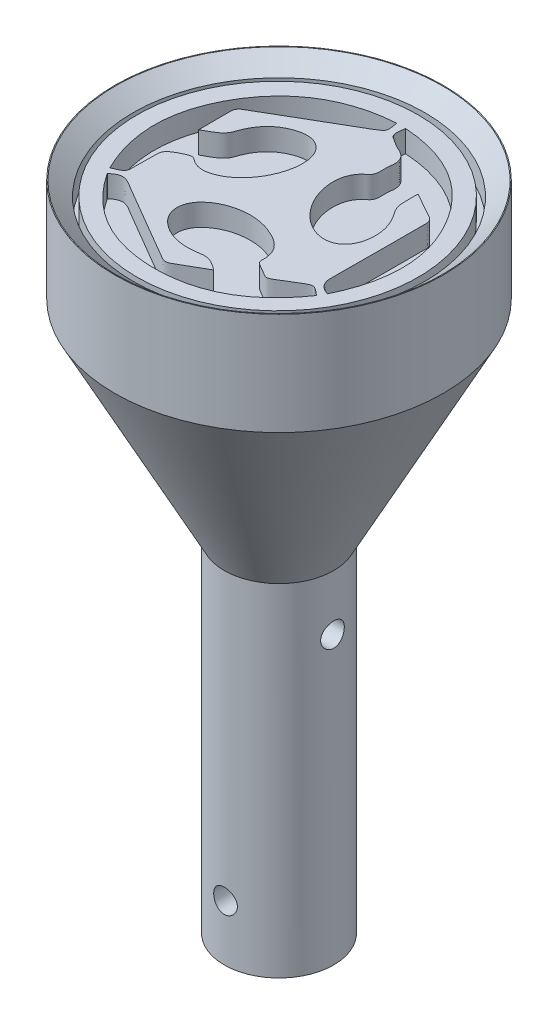
from build123d import *

# Parameters (mm, degrees)
SCHIZZO1_W                   = 22.5
SCHIZZO1_H                   = 14.04
ESTRUSIONE_ESTRUSIONE1_START = 9.96
SCHIZZO4_R                   = 19.25664473
ESTRUSIONE_ESTRUSIONE1_DEPTH = 3
TAGLIO_ESTRUSIONE1_START     = 8.039866
TAGLIO_ESTRUSIONE1_DEPTH     = 3
TAGLIO_ESTRUSIONE2_START     = 8.038452
TAGLIO_ESTRUSIONE2_DEPTH     = 3
TAGLIO_ESTRUSIONE3_START     = 8.039866
TAGLIO_ESTRUSIONE3_DEPTH     = 3
SCHIZZO17_R                  = 7.5
ESTRUSIONE_ESTRUSIONE2_DEPTH = 46.78
SCHIZZO18_R                  = 1.62
TAGLIO_ESTRUSIONE4_DEPTH     = 15
SCHIZZO19_R                  = 1.62
TAGLIO_ESTRUSIONE5_DEPTH     = 15


with BuildPart() as part:
    # Schizzo1 → Rivoluzione1 (revolve)
    with BuildSketch(Plane(origin=(0, 0, 0), x_dir=(-1, 0, 0), z_dir=(0, 0, -1)), mode=Mode.PRIVATE) as rivoluzione1_sk:
        with Locations((-11.25, 7.02)):
            Rectangle(SCHIZZO1_W, SCHIZZO1_H)
    revolve(rivoluzione1_sk.sketch.rotate(Axis((0, 0, 0), (0, 1, 0)), 270), axis=Axis((0, 0, 0), (0, 1, 0)))

    # Schizzo2 → Preforo Helicoil M39-1 (revolve, cut)
    with BuildSketch(Plane(origin=(0, 14.04, 0), x_dir=(0, 0, 1), z_dir=(1, 0, 0))):
        Polygon((0, 0), (0, 5), (20, 5), (20, 2), (22.383507185, 0), align=None)
    revolve(axis=Axis((0, 20.39, 0), (0, -1, 0)), mode=Mode.SUBTRACT)

    # Schizzo4 → Estrusione-Estrusione1 (add)
    with BuildSketch(Plane(origin=(0, 19.000000037, 0), x_dir=(0, 0, 1), z_dir=(0, -1, 0)).offset(ESTRUSIONE_ESTRUSIONE1_START)):
        with Locations(Location((-0.020858066, 0.208813711, 0), (0, 0, 180))):
            Circle(SCHIZZO4_R)
    extrude(amount=-ESTRUSIONE_ESTRUSIONE1_DEPTH)

    # Schizzo5 → Taglio-Estrusione1 (cut)
    with BuildSketch(Plane(origin=(0, 4.000133911, 0), x_dir=(1, 0, 0), z_dir=(0, 1, 0)).offset(TAGLIO_ESTRUSIONE1_START)):
        with BuildLine():
            ThreePointArc((-14.498983829, -9.052170214), (-14.514745196, -9.026539942), (-14.529323026, -9.000218499))
            add(Edge.make_bspline(
                [(-14.529323026, -9.000218499), (-14.529641415, -8.999151133), (-14.530280637, -8.997008207), (-14.530056766, -8.993645384), (-14.529950089, -8.990316308), (-14.529798352, -8.986975715), (-14.529686471, -8.983637022), (-14.529608776, -8.980296544), (-14.529561219, -8.976955745), (-14.529555498, -8.974728319), (-14.529552637, -8.973614621)],
                knots=[0, 0, 0, 0, 0.124118525, 0.24918984, 0.374331297, 0.499471254, 0.624605389, 0.749736518, 0.874870032, 1, 1, 1, 1], degree=3))
            add(Edge.make_bspline(
                [(-14.529552637, -8.973614621), (-14.409052554, -8.866308483), (-14.168089634, -8.651729374), (-13.748223192, -8.402122462), (-13.275247677, -8.2700587), (-12.782002183, -8.293560383), (-12.324948959, -8.466527336), (-11.898171374, -8.698032627), (-11.485510148, -8.95554959), (-11.067143204, -9.205223011), (-10.649380013, -9.455939957), (-10.230793941, -9.705263438), (-9.811813527, -9.953926531), (-9.392372075, -10.201811774), (-8.972535733, -10.449029569), (-8.552334742, -10.695629499), (-8.131808515, -10.941677707), (-7.710993915, -11.187235956), (-7.289928487, -11.43236718), (-6.868649592, -11.677134002), (-6.447194642, -11.921599127), (-6.025601034, -12.165825237), (-5.603906172, -12.409875024), (-5.182147019, -12.653811407), (-4.760359974, -12.897697732), (-4.338581019, -13.141597277), (-3.916846834, -13.385574084), (-3.495192366, -13.62968877), (-3.073660304, -13.874014021), (-2.652264596, -14.118577389), (-2.231106925, -14.363539417), (-1.81016831, -14.608918463), (-1.390399259, -14.856151018), (-0.968756814, -15.099962757), (-0.556932312, -15.354818005), (-0.068927793, -15.480438957), (0.405268878, -15.318576726), (0.807838051, -15.054215883), (1.226212551, -14.809801259), (1.643583004, -14.565166166), (2.063596443, -14.32475606), (2.484599852, -14.086225997), (2.906395128, -13.849068901), (3.328360689, -13.612223534), (3.750130375, -13.375026019), (4.030535608, -13.215527538), (4.170737876, -13.135778495)],
                knots=[0, 0, 0, 0, 0.022616665, 0.045226338, 0.067917642, 0.090546644, 0.113216619, 0.135873059, 0.158665913, 0.181457604, 0.204249116, 0.227040562, 0.249832034, 0.272623544, 0.295415086, 0.318206693, 0.340998385, 0.363790165, 0.386582029, 0.409373959, 0.432165929, 0.454957905, 0.47774985, 0.500541719, 0.523333537, 0.546125354, 0.568917168, 0.591708978, 0.614500788, 0.637292605, 0.660084418, 0.682876215, 0.70566804, 0.728459882, 0.751197773, 0.773725796, 0.7962676, 0.818905442, 0.841546098, 0.86418361, 0.886819813, 0.909455758, 0.932091839, 0.954728002, 0.977364057, 1, 1, 1, 1], degree=3))
            add(Edge.make_bspline(
                [(4.155731732, -13.108891566), (4.156691981, -13.109754626), (4.15861866, -13.111486302), (4.160588929, -13.114859411), (4.162333043, -13.118311759), (4.163929593, -13.121847599), (4.165547525, -13.125370387), (4.16720543, -13.128875301), (4.168917083, -13.132354713), (4.170130865, -13.134637085), (4.170737876, -13.135778495)],
                knots=[0, 0, 0, 0, 0.124254982, 0.249310022, 0.374365334, 0.499493504, 0.624630922, 0.74974305, 0.874846877, 1, 1, 1, 1], degree=3))
            add(Edge.make_bspline(
                [(4.155731732, -13.108891566), (4.075820273, -13.050477393), (3.916025382, -12.933669534), (3.674759095, -12.760698937), (3.428628585, -12.594570584), (3.175299252, -12.439678709), (2.913373983, -12.300703536), (2.639063663, -12.188160155), (2.353445783, -12.108480569), (2.06065572, -12.062675555), (1.764865582, -12.052075006), (1.469290044, -12.07579926), (1.177331374, -12.130723075), (0.88365547, -12.177388103), (0.589312141, -12.212779896), (0.295044662, -12.238438702), (0.000719186, -12.253522362), (-0.293638793, -12.257841528), (-0.588037493, -12.251073272), (-0.882475791, -12.232813283), (-1.177019681, -12.202707839), (-1.471513612, -12.160241407), (-1.765065336, -12.104659953), (-2.056157118, -12.035992408), (-2.343058892, -11.954007922), (-2.624762983, -11.858436651), (-2.901067029, -11.749410721), (-3.171987385, -11.62660792), (-3.43742209, -11.489876301), (-3.696428071, -11.33940903), (-3.947741703, -11.176145924), (-4.190178787, -11.001002543), (-4.423481487, -10.814702251), (-4.648435854, -10.617672081), (-4.859791301, -10.404620169), (-5.053604424, -10.175135454), (-5.227266517, -9.930562345), (-5.378292993, -9.671584822), (-5.504995502, -9.399232978), (-5.605614856, -9.116189694), (-5.680519345, -8.825916354), (-5.728476909, -8.529913774), (-5.746337242, -8.2299179), (-5.73276227, -7.929848719), (-5.687238948, -7.63345459), (-5.610881081, -7.343137531), (-5.50559721, -7.061183485), (-5.374335842, -6.78994497), (-5.22129915, -6.530504128), (-5.047792584, -6.284419146), (-4.853711327, -6.054875075), (-4.642867901, -5.841272193), (-4.417618417, -5.642583231), (-4.181266658, -5.457164169), (-3.937209808, -5.283195769), (-3.686274, -5.121310361), (-3.428673402, -4.971636527), (-3.164436665, -4.834128872), (-2.89357941, -4.708731416), (-2.61623313, -4.595460253), (-2.333475342, -4.494604617), (-2.046875165, -4.406324473), (-1.757860116, -4.330540833), (-1.466924556, -4.266898265), (-1.174578551, -4.212592097), (-0.88059787, -4.168257616), (-0.584886187, -4.134094889), (-0.287294661, -4.110487087), (0.011860865, -4.097938033), (0.311692945, -4.096533975), (0.610930683, -4.106537474), (0.908677197, -4.128176579), (1.204529452, -4.161089374), (1.498432893, -4.205213809), (1.790356713, -4.260420884), (2.080268143, -4.326597687), (2.368132118, -4.40363365), (2.653915852, -4.491389236), (2.936946564, -4.589618186), (3.216379657, -4.69743429), (3.491446792, -4.813978795), (3.76192239, -4.938832558), (4.02815876, -5.071316653), (4.289793847, -5.212313388), (4.545544443, -5.364324477), (4.794304716, -5.529510016), (5.034882049, -5.709846974), (5.263409444, -5.907552136), (5.476245562, -6.122559944), (5.670366293, -6.354334672), (5.843127121, -6.603061041), (5.991470879, -6.867163507), (6.112627425, -7.144100279), (6.205798397, -7.431225148), (6.2709366, -7.726942421), (6.309523178, -8.028069832), (6.321353952, -8.332299613), (6.314258655, -8.633615582), (6.321888422, -8.941627065), (6.49610153, -9.210256947), (6.764768681, -9.358555144), (7.019323169, -9.526243958), (7.280405955, -9.685752179), (7.542174405, -9.843793026), (7.80613063, -9.997532578), (8.07286761, -10.149134889), (8.339385349, -10.290401677), (8.618677402, -10.450053244), (8.934671249, -10.369475993), (9.213786837, -10.246176423), (9.475681604, -10.080238991), (9.740157926, -9.92296645), (10.003430389, -9.76272359), (10.266722533, -9.602767323), (10.52982385, -9.44242235), (10.792908331, -9.282066942), (11.056049674, -9.121795243), (11.319340091, -8.961783197), (11.582548037, -8.801592908), (11.847036004, -8.643687744), (12.110500264, -8.484306762), (12.384771758, -8.345643802), (12.669998953, -8.224957128), (12.991160334, -8.21800134), (13.178393247, -8.309240062), (13.272177194, -8.354941042)],
                knots=[0, 0, 0, 0, 0.008034319, 0.01606582, 0.02409443, 0.032131028, 0.040157129, 0.048136479, 0.056147022, 0.064169184, 0.072133978, 0.080116229, 0.088180245, 0.096234621, 0.104249868, 0.112237298, 0.120205793, 0.128165255, 0.136126559, 0.144101637, 0.152103566, 0.160151765, 0.168244641, 0.176345604, 0.184418916, 0.192454344, 0.200481075, 0.208518686, 0.216587615, 0.224705739, 0.232821115, 0.24090249, 0.248971268, 0.257046694, 0.265161783, 0.273305361, 0.281400054, 0.289477913, 0.297605271, 0.305745057, 0.313825959, 0.321905899, 0.330046115, 0.338175072, 0.346240431, 0.35433964, 0.362497882, 0.370630308, 0.378766566, 0.386920977, 0.39503963, 0.403136334, 0.411260817, 0.419401961, 0.427508861, 0.43557951, 0.44363137, 0.451681898, 0.459748369, 0.467849174, 0.475989866, 0.484107043, 0.49218272, 0.500233953, 0.508274492, 0.516313453, 0.524360351, 0.532431171, 0.540538437, 0.548657552, 0.556762147, 0.564834047, 0.572882345, 0.580917809, 0.588950746, 0.596991145, 0.605048644, 0.613132503, 0.621250906, 0.629360482, 0.637438446, 0.645494314, 0.653536518, 0.661572187, 0.669612361, 0.677676266, 0.685798253, 0.694000002, 0.702180406, 0.710327919, 0.718508392, 0.72672554, 0.734874896, 0.743003055, 0.75118789, 0.759415059, 0.767620589, 0.775837587, 0.784008864, 0.792122151, 0.800375677, 0.808647462, 0.81691971, 0.825192162, 0.833464214, 0.841735582, 0.850003548, 0.858279252, 0.866592856, 0.874961386, 0.883296792, 0.891632428, 0.899968204, 0.90830408, 0.916640022, 0.924976, 0.933311987, 0.941647976, 0.949983923, 0.958319723, 0.966655569, 0.974957323, 0.983279456, 0.991624771, 1, 1, 1, 1], degree=3))
            add(Edge.make_bspline(
                [(13.272177194, -8.354941042), (13.388043543, -8.430277413), (13.620043902, -8.581124187), (13.937053153, -8.849887483), (14.14864483, -9.028425028), (14.254506885, -9.117749673)],
                knots=[0, 0, 0, 0, 0.332681763, 0.666132048, 1, 1, 1, 1], degree=3))
            add(Edge.make_bspline(
                [(14.254506885, -9.117749673), (14.075053373, -9.370683826), (13.716783562, -9.875653999), (13.148905777, -10.609117741), (12.551551147, -11.315878973), (11.922760401, -11.994039267), (11.260682295, -12.641908974), (10.563991144, -13.257326778), (9.834793867, -13.835179216), (9.076324337, -14.369798269), (8.292506094, -14.857321929), (7.483859742, -15.296691527), (6.65016663, -15.68740359), (5.791213562, -16.02899916), (4.908762911, -16.320177563), (4.009055595, -16.559660573), (3.098342069, -16.745844283), (2.181481358, -16.880450579), (1.259083249, -16.967526053), (0.331282153, -17.008672724), (-0.599307, -17.004514703), (-1.528086279, -16.957715488), (-2.450499166, -16.866147211), (-3.364118725, -16.727682635), (-4.268754066, -16.540252427), (-5.163856936, -16.301691634), (-6.04734271, -16.010652107), (-6.912754499, -15.66764445), (-7.753682495, -15.274510415), (-8.565803749, -14.833850751), (-9.349089911, -14.346719145), (-10.104000572, -13.813915136), (-10.830716259, -13.23647185), (-11.526794707, -12.617840227), (-12.189804552, -11.963259355), (-12.817860569, -11.277529426), (-13.411262278, -10.562742027), (-13.974719431, -9.822299344), (-14.324038354, -9.309160022), (-14.498983829, -9.052170214)],
                knots=[0, 0, 0, 0, 0.027123515, 0.054150718, 0.081105345, 0.108038152, 0.135009628, 0.162093856, 0.189307703, 0.216346649, 0.243213898, 0.269998881, 0.296794552, 0.323696514, 0.350802539, 0.378024634, 0.405083387, 0.432061321, 0.459039331, 0.486086228, 0.513258604, 0.540404847, 0.567396234, 0.594300666, 0.621190448, 0.648160455, 0.675280473, 0.70250375, 0.729534565, 0.756425014, 0.783271753, 0.810167143, 0.837198482, 0.864415017, 0.891580183, 0.918654899, 0.945712899, 0.972812001, 1, 1, 1, 1], degree=3))
        make_face()
    extrude(amount=-TAGLIO_ESTRUSIONE1_DEPTH, mode=Mode.SUBTRACT)

    # Schizzo6 → Taglio-Estrusione2 (cut)
    with BuildSketch(Plane(origin=(0, 4.001548122, 0), x_dir=(1, 0, 0), z_dir=(0, 1, 0)).offset(TAGLIO_ESTRUSIONE2_START)):
        with BuildLine():
            add(Edge.make_bspline(
                [(9.17650385, 9.829800932), (9.176688629, 9.831138941), (9.177058886, 9.833820024), (9.178982287, 9.837425978), (9.181099984, 9.840855513), (9.183333137, 9.844233545), (9.185577905, 9.847598469), (9.187756913, 9.851007543), (9.1898755, 9.854453779), (9.191215816, 9.856793858), (9.191885921, 9.857963804)],
                knots=[0, 0, 0, 0, 0.124369945, 0.249210715, 0.374334723, 0.499487279, 0.624650399, 0.749768428, 0.874894189, 1, 1, 1, 1], degree=3))
            add(Edge.make_bspline(
                [(14.804626018, -8.177594632), (14.647878355, -8.118839571), (14.334315519, -8.001304144), (13.902950666, -7.73993255), (13.539866805, -7.387925233), (13.300787849, -6.94116024), (13.189514485, -6.449245649), (13.176715427, -5.946856674), (13.19142718, -5.445451184), (13.196434062, -4.943375969), (13.204186759, -4.441465994), (13.210490516, -3.939513752), (13.216013153, -3.43755884), (13.219945518, -2.935587154), (13.222727625, -2.433608117), (13.224570873, -1.931623563), (13.225736714, -1.429636669), (13.226515008, -0.927649326), (13.227008525, -0.425662147), (13.22723694, 0.076325036), (13.227270391, 0.578312318), (13.227158594, 1.080299616), (13.226982482, 1.582286881), (13.226718543, 2.08427408), (13.226313083, 2.586261174), (13.22581675, 3.088248169), (13.225249333, 3.590235183), (13.224649716, 4.092221843), (13.224011266, 4.594209631), (13.223490322, 5.096193153), (13.222636845, 5.598192708), (13.223209094, 6.100131816), (13.219030622, 6.602213297), (13.242975077, 7.100418456), (13.090178923, 7.598598131), (12.685872311, 7.917395725), (12.239255808, 8.132558752), (11.802176708, 8.377539001), (11.364199703, 8.618650688), (10.929099767, 8.865534022), (10.495171209, 9.114289264), (10.061272705, 9.363144162), (9.629198534, 9.615168097), (9.33765388, 9.777033518), (9.191885921, 9.857963804)],
                knots=[0, 0, 0, 0, 0.023831547, 0.047673359, 0.071397487, 0.095035098, 0.118812603, 0.142637792, 0.166500547, 0.190357215, 0.21421387, 0.238070507, 0.261927124, 0.285783698, 0.309640318, 0.333497015, 0.357353751, 0.381210442, 0.405067101, 0.428923763, 0.452780429, 0.476637097, 0.500493763, 0.524350427, 0.54820709, 0.572063755, 0.59592042, 0.619777085, 0.643633749, 0.667490413, 0.691347078, 0.715203739, 0.739060299, 0.762905413, 0.786329012, 0.809834736, 0.833601741, 0.857373124, 0.881144356, 0.904915523, 0.928686885, 0.95245826, 0.976229842, 1, 1, 1, 1], degree=3))
            add(Edge.make_bspline(
                [(0.537941933, 16.795949374), (0.857301552, 16.773303621), (1.495883581, 16.728021846), (2.446102184, 16.599302949), (3.386684682, 16.432531052), (4.313826922, 16.218576023), (5.226443015, 15.957055397), (6.123939367, 15.645516766), (7.005688829, 15.281937321), (7.866944514, 14.864894712), (8.701011214, 14.397112162), (9.500661543, 13.880663282), (10.263793575, 13.318685433), (10.99081335, 12.711854944), (11.682387841, 12.061019407), (12.338235623, 11.367758672), (12.956011355, 10.636537618), (13.533257528, 9.873331904), (14.068821691, 9.083078049), (14.565164889, 8.268432557), (15.024377968, 7.430364732), (15.441172587, 6.568310022), (15.809324001, 5.68528383), (16.125612411, 4.785434273), (16.387747983, 3.871128694), (16.593963706, 2.942073832), (16.743900774, 1.999035288), (16.836683826, 1.046365359), (16.869181455, 0.090787164), (16.841174583, -0.861528918), (16.758135761, -1.808754149), (16.62094323, -2.751388183), (16.4314128, -3.688196804), (16.19204453, -4.615257865), (15.907426591, -5.529254157), (15.580179867, -6.427631819), (15.217841403, -7.313445372), (14.94249049, -7.889281355), (14.804626018, -8.177594632)],
                knots=[0, 0, 0, 0, 0.027962911, 0.055913809, 0.083719777, 0.111390974, 0.138996706, 0.166615596, 0.19434156, 0.22226975, 0.250160816, 0.277829949, 0.305375968, 0.332902682, 0.360508947, 0.388290381, 0.41622704, 0.444091655, 0.471847235, 0.499588285, 0.527397813, 0.555299247, 0.583197155, 0.610930022, 0.638578016, 0.666238599, 0.694015432, 0.721945624, 0.749804083, 0.777484994, 0.805124348, 0.832825513, 0.860656726, 0.888580433, 0.916433376, 0.944249941, 0.972086701, 1, 1, 1, 1], degree=3))
            add(Edge.make_bspline(
                [(9.17650385, 9.829800932), (9.175583818, 9.719859889), (9.173743753, 9.499977815), (9.171199443, 9.170153127), (9.168693325, 8.840319861), (9.165980389, 8.51049994), (9.162978776, 8.180988329), (9.169261381, 7.852178101), (9.193222369, 7.524589929), (9.244532629, 7.199489874), (9.32973379, 6.880863255), (9.45145717, 6.575123754), (9.605278817, 6.285080157), (9.794328424, 6.017848), (9.985862789, 5.752926354), (10.162249459, 5.478556045), (10.3277934, 5.199418779), (10.480560787, 4.914388826), (10.620544001, 4.623594831), (10.747252491, 4.326777713), (10.86034378, 4.023762175), (10.958851701, 3.714154881), (11.041526951, 3.398773346), (11.107370815, 3.079700576), (11.155447565, 2.759012069), (11.185699987, 2.437789548), (11.198214031, 2.115997301), (11.192840507, 1.793695493), (11.170890146, 1.470940707), (11.134539301, 1.147835747), (11.080519272, 0.826351581), (11.00621727, 0.509098097), (10.909623336, 0.198156948), (10.788687232, -0.104813572), (10.642983422, -0.397094036), (10.471755086, -0.675013311), (10.272930861, -0.934258168), (10.046267325, -1.169596161), (9.793833781, -1.376433852), (9.518653046, -1.551101105), (9.2247005, -1.692976313), (8.916273041, -1.801703269), (8.597033571, -1.873847054), (8.27220756, -1.910106289), (7.945911941, -1.911677721), (7.621686687, -1.882830997), (7.300693965, -1.829109191), (6.984147224, -1.751956533), (6.674294225, -1.652982675), (6.372775104, -1.532987444), (6.079816267, -1.394158702), (5.794928309, -1.238404634), (5.518336795, -1.067632495), (5.250310157, -0.884357152), (4.991265158, -0.690080165), (4.741759117, -0.485141154), (4.501669965, -0.269775864), (4.270907248, -0.044146692), (4.049368965, 0.191567246), (3.837054699, 0.437071336), (3.634526691, 0.691339364), (3.442158101, 0.953055779), (3.260139597, 1.221039421), (3.088033632, 1.494844552), (2.92525299, 1.774153272), (2.772257544, 2.059279616), (2.629555522, 2.350505569), (2.497879776, 2.647564674), (2.378070615, 2.949712259), (2.27072905, 3.255877869), (2.176248666, 3.565357273), (2.094901693, 3.877926772), (2.026357485, 4.193455935), (1.971395604, 4.512253004), (1.930586019, 4.834157887), (1.904958468, 5.158339799), (1.89647101, 5.483536925), (1.905886057, 5.808310344), (1.934702086, 6.13200734), (1.982541741, 6.453826469), (2.051721775, 6.772006599), (2.144837142, 7.0835704), (2.265288991, 7.385496079), (2.41411614, 7.674719578), (2.589291664, 7.948924888), (2.789487189, 8.204712009), (3.014057405, 8.439495148), (3.258632088, 8.65457346), (3.526502159, 8.845354773), (3.728868297, 9.110350785), (3.853304436, 9.417505737), (3.906794813, 9.743687339), (3.907616803, 10.072986417), (3.904294346, 10.402280672), (3.892041603, 10.731554115), (3.8949409, 11.062005319), (3.942389114, 11.388682182), (3.981081576, 11.715545521), (3.984560577, 12.044790621), (3.940225625, 12.369992194), (3.842577118, 12.683479422), (3.686540581, 12.972674241), (3.478322498, 13.227491498), (3.229998216, 13.442863695), (2.954699348, 13.620154022), (2.663029696, 13.768091207), (2.358827777, 13.886655956), (2.069406032, 14.038015738), (1.792053235, 14.208233524), (1.513761398, 14.376853656), (1.236521002, 14.547324352), (0.962626031, 14.722964896), (0.697009468, 14.911131478), (0.485998073, 15.168908877), (0.410327968, 15.494879849), (0.434265773, 15.820731834), (0.460352234, 16.146389761), (0.48877845, 16.47240128), (0.521547391, 16.688055822), (0.537941933, 16.795949374)],
                knots=[0, 0, 0, 0, 0.008656257, 0.017312512, 0.025968768, 0.034625628, 0.043281148, 0.051912622, 0.060512063, 0.069121644, 0.077787297, 0.086421565, 0.094980109, 0.103565311, 0.112165214, 0.120721274, 0.129233015, 0.137712001, 0.146173736, 0.154634597, 0.163112621, 0.171628838, 0.180203974, 0.188770749, 0.197267187, 0.205721939, 0.214160672, 0.222608866, 0.231088568, 0.23962175, 0.248198675, 0.256739484, 0.265256574, 0.27380986, 0.282395402, 0.2909383, 0.299471823, 0.308068414, 0.316606076, 0.32510457, 0.333669285, 0.342250957, 0.350796786, 0.359381119, 0.367933234, 0.376443169, 0.384979059, 0.39353413, 0.402073415, 0.410567999, 0.419065116, 0.42758214, 0.436118286, 0.444647707, 0.453138008, 0.461603958, 0.470060934, 0.478523693, 0.487006303, 0.495522089, 0.504071292, 0.512593132, 0.521089081, 0.529571378, 0.53805061, 0.546537016, 0.555042235, 0.56357833, 0.572113464, 0.580626207, 0.589115183, 0.597582449, 0.606048293, 0.614529722, 0.623044233, 0.631586874, 0.640122285, 0.648644249, 0.657153579, 0.665693758, 0.674244232, 0.682768576, 0.691266901, 0.699799888, 0.708339463, 0.716848045, 0.725332472, 0.733878326, 0.742475122, 0.751097095, 0.759701412, 0.768326266, 0.776947509, 0.785598922, 0.794256621, 0.802896936, 0.811561418, 0.820215122, 0.828802457, 0.837408422, 0.845952068, 0.854512871, 0.863115019, 0.87171751, 0.880284197, 0.88883548, 0.897422943, 0.905965683, 0.914503581, 0.923043495, 0.931585176, 0.940125341, 0.948665128, 0.957169498, 0.965668127, 0.974249814, 0.982829876, 0.991409661, 1, 1, 1, 1], degree=3))
        make_face()
    extrude(amount=-TAGLIO_ESTRUSIONE2_DEPTH, mode=Mode.SUBTRACT)

    # Schizzo7 → Taglio-Estrusione3 (cut)
    with BuildSketch(Plane(origin=(0, 4.000133911, 0), x_dir=(1, 0, 0), z_dir=(0, 1, 0)).offset(TAGLIO_ESTRUSIONE3_START)):
        with BuildLine():
            add(Edge.make_bspline(
                [(-13.473470012, 2.474500198), (-13.382860677, 2.521105123), (-13.201644539, 2.61431367), (-12.938036974, 2.769080341), (-12.672826774, 2.920793713), (-12.4100886, 3.076649722), (-12.148676116, 3.234588212), (-11.891148034, 3.399414001), (-11.641640498, 3.576182917), (-11.411708842, 3.776795053), (-11.209489559, 4.003806299), (-11.035363291, 4.253588523), (-10.890141965, 4.524238588), (-10.777519497, 4.812933328), (-10.685070543, 5.109482991), (-10.574344444, 5.399494252), (-10.454234277, 5.684219144), (-10.321766258, 5.962544315), (-10.176781809, 6.234245836), (-10.018855316, 6.499105833), (-9.847696173, 6.756984616), (-9.663089758, 7.007717642), (-9.464664579, 7.250011546), (-9.253370011, 7.482415314), (-9.030409803, 7.70291899), (-8.796229169, 7.909886867), (-8.551494609, 8.103207068), (-8.296067805, 8.282982825), (-8.030162685, 8.449085093), (-7.754992497, 8.600877764), (-7.472183499, 8.737877351), (-7.18348493, 8.860100551), (-6.889708973, 8.96782649), (-6.591467369, 9.062118867), (-6.288570566, 9.143243357), (-5.98060102, 9.208010227), (-5.668094765, 9.248103299), (-5.353385573, 9.256690471), (-5.03938528, 9.235082689), (-4.728853447, 9.182942974), (-4.425638029, 9.09865134), (-4.13347819, 8.981680264), (-3.855980163, 8.832845088), (-3.597269513, 8.653537639), (-3.360293718, 8.446347926), (-3.147409337, 8.214015318), (-2.959858149, 7.960474905), (-2.798910784, 7.68918623), (-2.664478272, 7.404167315), (-2.555835926, 7.108875298), (-2.472796338, 6.806445755), (-2.413394265, 6.498529749), (-2.376965238, 6.186538394), (-2.355950071, 5.873025424), (-2.349066694, 5.559535172), (-2.356252046, 5.246963065), (-2.376997583, 4.935562037), (-2.41130034, 4.625396627), (-2.458967831, 4.316372516), (-2.519760429, 4.008536801), (-2.593202429, 3.702924033), (-2.678517039, 3.400729151), (-2.774812, 3.102989534), (-2.881387933, 2.8097684), (-2.997608449, 2.520850378), (-3.122600517, 2.235842346), (-3.256861376, 1.954897054), (-3.400677646, 1.678090493), (-3.554405613, 1.405555137), (-3.718409996, 1.137981698), (-3.892257132, 0.876225353), (-4.075453189, 0.621526363), (-4.267803879, 0.374779831), (-4.468990282, 0.136175014), (-4.67909148, -0.094284978), (-4.898199967, -0.31668737), (-5.126476783, -0.531013945), (-5.364431263, -0.736025375), (-5.611683687, -0.930359921), (-5.867698437, -1.112188865), (-6.132135756, -1.280109352), (-6.404516635, -1.43392874), (-6.685029265, -1.573248561), (-6.973675046, -1.697497767), (-7.269153614, -1.806642942), (-7.570164092, -1.899395559), (-7.877027651, -1.970188747), (-8.189521224, -2.013150004), (-8.505138266, -2.024569648), (-8.820513139, -2.00282613), (-9.131475297, -1.946176502), (-9.433814295, -1.854378972), (-9.721357598, -1.724589197), (-9.993517362, -1.564184169), (-10.250852361, -1.383784329), (-10.495295969, -1.174613547), (-10.818616683, -1.126922711), (-11.126499078, -1.188293382), (-11.406215638, -1.323611115), (-11.688776353, -1.447104896), (-11.966213699, -1.582845602), (-12.239863237, -1.725865333), (-12.508138443, -1.879207629), (-12.77016254, -2.042006514), (-13.025492175, -2.217578899), (-13.236315561, -2.447384759), (-13.384379884, -2.722159661), (-13.456901673, -3.025984316), (-13.467000831, -3.336513833), (-13.466938333, -3.647059147), (-13.468298378, -3.95774023), (-13.468620525, -4.268270891), (-13.468691697, -4.578833414), (-13.46876733, -4.889404235), (-13.469293084, -5.199967244), (-13.47059245, -5.510503246), (-13.473287348, -5.82098024), (-13.476928507, -6.13141944), (-13.485052122, -6.441641647), (-13.486327633, -6.752151872), (-13.521986392, -7.063102158), (-13.638705858, -7.365992306), (-13.884449837, -7.581703509), (-14.162520267, -7.738513644), (-14.452142811, -7.875112337), (-14.746940537, -7.998946591), (-14.943939954, -8.080489591), (-15.042454941, -8.121267415)],
                knots=[0, 0, 0, 0, 0.007833935, 0.015667651, 0.023500628, 0.031330917, 0.039158766, 0.04698637, 0.054840926, 0.062652792, 0.07039649, 0.078159359, 0.086017017, 0.093956405, 0.101949186, 0.109900024, 0.117815782, 0.125709005, 0.133594659, 0.141489978, 0.14941343, 0.157386908, 0.165423764, 0.173485846, 0.181530178, 0.189526067, 0.197507081, 0.205501506, 0.213533589, 0.22160492, 0.229656476, 0.237688286, 0.245703469, 0.253709932, 0.261734367, 0.269808532, 0.27789401, 0.285927857, 0.293978451, 0.302061537, 0.31010068, 0.318133165, 0.326213262, 0.334264304, 0.342287472, 0.350369502, 0.358449676, 0.366496502, 0.3745877, 0.382649889, 0.390662335, 0.398679428, 0.406741057, 0.414801685, 0.422835331, 0.430845928, 0.438837099, 0.446827635, 0.454835586, 0.462874951, 0.470950542, 0.478999819, 0.487016165, 0.495009064, 0.502986899, 0.510960144, 0.518937383, 0.526927521, 0.534943655, 0.542994564, 0.551056188, 0.559102435, 0.56711532, 0.575109355, 0.583097286, 0.591091078, 0.599112005, 0.607169878, 0.615236786, 0.623287081, 0.631307338, 0.639314796, 0.647331564, 0.655381065, 0.663469125, 0.671543751, 0.679587464, 0.687659966, 0.695762865, 0.703831591, 0.711921966, 0.720020169, 0.728064623, 0.736129317, 0.744246926, 0.752337654, 0.76032714, 0.768308576, 0.776216984, 0.784128278, 0.792042074, 0.79995633, 0.807872427, 0.815793261, 0.823692026, 0.831617477, 0.839526509, 0.847432436, 0.855396667, 0.863365302, 0.871325077, 0.879285135, 0.887245986, 0.895207164, 0.903168126, 0.911128367, 0.919087467, 0.92704512, 0.935001179, 0.942955664, 0.950904062, 0.95902824, 0.967204863, 0.975408837, 0.983604546, 0.991801001, 1, 1, 1, 1], degree=3))
            add(Edge.make_bspline(
                [(-15.042454941, -8.121267415), (-15.137357082, -7.930031797), (-15.327154806, -7.547573772), (-15.584652446, -6.961105363), (-15.8278089, -6.369413107), (-16.05152469, -5.77146764), (-16.255708641, -5.168501803), (-16.439365044, -4.560463232), (-16.601934237, -3.947227295), (-16.742658658, -3.328600136), (-16.860782982, -2.704402358), (-16.955627584, -2.074355584), (-17.026210833, -1.439318727), (-17.072333863, -0.801879641), (-17.09318397, -0.164892538), (-17.08744447, 0.469848314), (-17.054714629, 1.102056538), (-16.995912638, 1.731740027), (-16.912000395, 2.359021644), (-16.802846996, 2.984000813), (-16.667572928, 3.606465175), (-16.506478201, 4.224780216), (-16.319729546, 4.836041389), (-16.10874793, 5.437797713), (-15.876670429, 6.029997346), (-15.626427724, 6.613957037), (-15.357753435, 7.189705566), (-15.06980396, 7.756867099), (-14.762147764, 8.315337663), (-14.434757519, 8.863902965), (-14.088542639, 9.40049598), (-13.724638966, 9.922962752), (-13.343905859, 10.430351336), (-12.946624242, 10.922780728), (-12.532615341, 11.400098935), (-12.102289681, 11.8627501), (-11.653542087, 12.308873916), (-11.185583335, 12.737661749), (-10.698197946, 13.148692262), (-10.192533127, 13.540144478), (-9.671284228, 13.909962112), (-9.137030805, 14.256412312), (-8.591121526, 14.579385305), (-8.033709605, 14.87941877), (-7.465035401, 15.156982867), (-6.885335665, 15.412539706), (-6.294809117, 15.64660221), (-5.693745946, 15.859436574), (-5.083735577, 16.050840288), (-4.467093245, 16.220706144), (-3.846015203, 16.369412434), (-3.221284768, 16.497509748), (-2.593109131, 16.606352238), (-1.961413526, 16.69457927), (-1.326902566, 16.769348508), (-0.901812995, 16.800875661), (-0.688992769, 16.816659666)],
                knots=[0, 0, 0, 0, 0.018636706, 0.037272124, 0.055904954, 0.074483211, 0.093000575, 0.111475315, 0.129927334, 0.148378638, 0.166853557, 0.185378716, 0.203992305, 0.222624242, 0.241163183, 0.259620223, 0.278027076, 0.296416849, 0.314820119, 0.33326658, 0.351792639, 0.370418546, 0.389036111, 0.407578893, 0.426077604, 0.444557563, 0.463037897, 0.481538461, 0.500080688, 0.518694581, 0.537301842, 0.555822536, 0.574272006, 0.592673746, 0.611050702, 0.629425976, 0.647825808, 0.666281084, 0.684824322, 0.703473796, 0.722095641, 0.740607123, 0.759050865, 0.777458612, 0.795860344, 0.814284259, 0.832756724, 0.851306731, 0.869941585, 0.888563074, 0.90713823, 0.925688171, 0.944232477, 0.962788845, 0.981370311, 1, 1, 1, 1], degree=3))
            add(Edge.make_bspline(
                [(-0.688992769, 16.816659666), (-0.661050657, 16.667396135), (-0.605165761, 16.368865481), (-0.547881205, 15.920593258), (-0.489508664, 15.461859256), (-0.70380656, 15.031611534), (-1.08238221, 14.778476747), (-1.459969665, 14.537204401), (-1.850411053, 14.312737296), (-2.23787517, 14.084020691), (-2.626414606, 13.856799151), (-3.014885724, 13.629553113), (-3.403583743, 13.402670525), (-3.792438067, 13.176062209), (-4.181402193, 12.949640176), (-4.570401188, 12.723278141), (-4.959447055, 12.496996247), (-5.348528544, 12.270775376), (-5.737640649, 12.044606924), (-6.126776689, 11.818479468), (-6.515930436, 11.59238235), (-6.905095521, 11.366304669), (-7.294265692, 11.140235727), (-7.683434371, 10.914164265), (-8.072596161, 10.688081058), (-8.461741287, 10.4619693), (-8.850876406, 10.235840418), (-9.240013513, 10.009714984), (-9.629148248, 9.783585502), (-10.018280403, 9.557451457), (-10.407409445, 9.33131252), (-10.796531978, 9.105160645), (-11.185656376, 8.879018466), (-11.574746808, 8.652793614), (-11.963932483, 8.42682305), (-12.352729775, 8.199839601), (-12.74294853, 7.976559217), (-13.127875817, 7.742547181), (-13.420001067, 7.384038568), (-13.510624413, 6.934575037), (-13.478537892, 6.489885883), (-13.47297591, 6.043450623), (-13.47394526, 5.597342231), (-13.473207274, 5.151212184), (-13.473177074, 4.705096106), (-13.473136591, 4.258976272), (-13.473219773, 3.812857438), (-13.47332937, 3.366738327), (-13.473440906, 2.920619277), (-13.47346031, 2.623206557), (-13.473470012, 2.474500198)],
                knots=[0, 0, 0, 0, 0.021096293, 0.042193094, 0.063222942, 0.084022819, 0.104865991, 0.12570567, 0.146576307, 0.167446908, 0.188317487, 0.209188058, 0.230058632, 0.250929219, 0.271799821, 0.292670429, 0.313541045, 0.334411666, 0.355282294, 0.376152926, 0.397023561, 0.417894198, 0.438764835, 0.459635472, 0.480506105, 0.501376735, 0.522247362, 0.543117989, 0.563988616, 0.584859243, 0.60572987, 0.626600497, 0.647471124, 0.668341752, 0.689212379, 0.710083005, 0.730954142, 0.751824891, 0.772481819, 0.793102017, 0.813807771, 0.834499615, 0.855187167, 0.875874716, 0.896562262, 0.917249808, 0.937937355, 0.958624903, 0.979312452, 1, 1, 1, 1], degree=3))
        make_face()
    extrude(amount=-TAGLIO_ESTRUSIONE3_DEPTH, mode=Mode.SUBTRACT)


with BuildPart() as body_2:
    # Schizzo9 → Rivoluzione2 (revolve)
    with BuildSketch(Plane.XY, mode=Mode.PRIVATE) as rivoluzione2_sk:
        Polygon((0, 0), (22.5, 0), (7.5, -28.52), (0, -28.52), align=None)
    revolve(rivoluzione2_sk.sketch.rotate(Axis((0, -28.52, 0), (0, 1, 0)), 180), axis=Axis((0, -28.52, 0), (0, 1, 0)))

    # Schizzo17 → Estrusione-Estrusione2 (add)
    with BuildSketch(Plane(origin=(0, -28.52, 0), x_dir=(-1, 0, 0), z_dir=(0, -1, 0))):
        Circle(SCHIZZO17_R)
    extrude(amount=ESTRUSIONE_ESTRUSIONE2_DEPTH)

    # Schizzo18 → Taglio-Estrusione4 (cut, symmetric)
    with BuildSketch(Plane(origin=(0, 0, 0), x_dir=(0, 0, -1), z_dir=(1, 0, 0))):
        with Locations((0, -36.11)):
            Circle(SCHIZZO18_R)
    extrude(amount=TAGLIO_ESTRUSIONE4_DEPTH, both=True, mode=Mode.SUBTRACT)

    # Schizzo19 → Taglio-Estrusione5 (cut, symmetric)
    with BuildSketch(Plane.XY):
        with Locations((0, -67.68)):
            Circle(SCHIZZO19_R)
    extrude(amount=TAGLIO_ESTRUSIONE5_DEPTH, both=True, mode=Mode.SUBTRACT)


solid = Compound([part.part, body_2.part])
